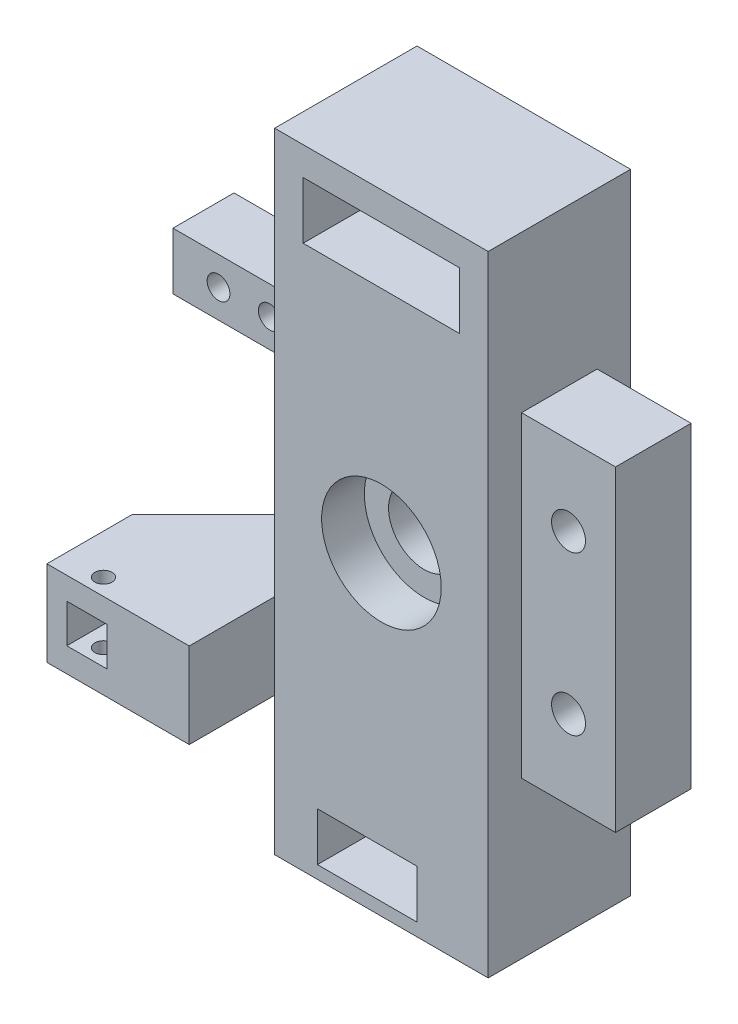
from build123d import *

# Parameters (mm, degrees)
SKETCH1_W                         = 75
SKETCH1_H                         = 50
BE_MAIN_UPRIGHT_BODY_DEPTH        = 221
SKETCH4_R                         = 12.5
CE_THROUGH_HOLE_DEPTH             = 230.667694724
SKETCH2_R                         = 21
CE_INNER_BEARING_DEPTH            = 15
SKETCH3_R                         = 23.5
CE_OUTER_BEARING_DEPTH            = 15
SKETCH7_W                         = 26.55070312
SKETCH7_H                         = 111.194580496
BE_CALIPER_MOUNT_DEPTH            = 33
SKETCH8_W                         = 21.441072272
SKETCH8_H                         = 20
BE_TEMP_SENSOR_MOUNT_DEPTH        = 50
SKETCH9_W                         = 60
SKETCH9_H                         = 30
BE_TIE_ROD_MOUNT_DEPTH            = 50
SKETCH10_R                        = 5.968024458
CE_CALIPER_HOLES_DEPTH            = 242.325913005
SKETCH12_R                        = 4
CE_TOP_CLEVIS_HOLES_DEPTH         = 243.893495178
SKETCH13_W                        = 55
SKETCH13_H                        = 20
CE_TOP_CLEVIS_SPACE_DEPTH         = 35
SKETCH14_W                        = 25
SKETCH14_H                        = 12
CE_BOTTOM_CLEVIS_SPACE_DEPTH      = 243.893495178
SKETCH15_W                        = 25
SKETCH15_H                        = 5
CE_EXPAND_BOTTOM_CLEVIS_DEPTH     = 243.893495178
CE_WIDEN_BOTTOM_CLEVIS_DEPTH      = 240.74121548
CE_WIDEN_BOTTOM_CLEVIS_DEPTH_BACK = 240.74121548
SKETCH16_W                        = 10.007554032
SKETCH16_H                        = 17
CHAMFER1_SIZE                     = 30
SKETCH18_W                        = 14.04398123
SKETCH18_H                        = 13.562779604
CUT_EXTRUDE1_DEPTH                = 20
SKETCH19_R                        = 3
CUT_EXTRUDE2_DEPTH                = 177.032667423
SKETCH20_R                        = 4
CUT_EXTRUDE3_DEPTH                = 242.780729009


with BuildPart() as part:
    # Sketch1 → BE - main upright body (new body)
    with BuildSketch(Plane(origin=(0, 0, 0), x_dir=(1, 0, 0), z_dir=(0, 1, 0))):
        Rectangle(SKETCH1_W, SKETCH1_H)
    extrude(amount=BE_MAIN_UPRIGHT_BODY_DEPTH)

    # Sketch4 → CE - Through hole (cut, through all)
    with BuildSketch(Plane.XY.offset(25)):
        with Locations((0, 110.5)):
            Circle(SKETCH4_R)
    extrude(amount=-CE_THROUGH_HOLE_DEPTH, mode=Mode.SUBTRACT)

    # Sketch2 → CE - Inner bearing (cut)
    with BuildSketch(Plane.XY.offset(25)):
        with Locations((0, 110.5)):
            Circle(SKETCH2_R)
    extrude(amount=-CE_INNER_BEARING_DEPTH, mode=Mode.SUBTRACT)

    # Sketch3 → CE - Outer bearing (cut)
    with BuildSketch(Plane(origin=(0, 0, -25), x_dir=(-1, 0, 0), z_dir=(0, 0, -1))):
        with Locations((0, 110.5)):
            Circle(SKETCH3_R)
    extrude(amount=-CE_OUTER_BEARING_DEPTH, mode=Mode.SUBTRACT)

    # Sketch7 → BE - caliper mount (add)
    with BuildSketch(Plane(origin=(37.5, 0, 0), x_dir=(0, 0, -1), z_dir=(1, 0, 0))):
        with Locations((0, 110.5)):
            Rectangle(SKETCH7_W, SKETCH7_H)
    extrude(amount=BE_CALIPER_MOUNT_DEPTH)

    # Sketch8 → BE - temp sensor mount (add)
    with BuildSketch(Plane.ZY.offset(37.5)):
        with Locations((0, 148.452249223)):
            Rectangle(SKETCH8_W, SKETCH8_H)
    extrude(amount=BE_TEMP_SENSOR_MOUNT_DEPTH)

    # Sketch9 → BE - tie rod mount (add)
    with BuildSketch(Plane.ZY.offset(37.5)):
        with Locations((25, 63.5)):
            Rectangle(SKETCH9_W, SKETCH9_H)
    extrude(amount=BE_TIE_ROD_MOUNT_DEPTH)

    # Sketch10 → CE - caliper holes (cut, through all)
    with BuildSketch(Plane.XY.offset(13.27535156)):
        with Locations((54, 138.298645124)):
            Circle(SKETCH10_R)
        with Locations((54, 82.701354876)):
            Circle(SKETCH10_R)
    extrude(amount=-CE_CALIPER_HOLES_DEPTH, mode=Mode.SUBTRACT)

    # Sketch12 → CE - top clevis holes (cut, through all)
    with BuildSketch(Plane.XY.offset(25)):
        with Locations((-12.5, 201)):
            Circle(SKETCH12_R)
        with Locations((12.5, 201)):
            Circle(SKETCH12_R)
    extrude(amount=-CE_TOP_CLEVIS_HOLES_DEPTH, mode=Mode.SUBTRACT)

    # Sketch13 → CE - top clevis space (cut)
    with BuildSketch(Plane.XY.offset(25)):
        with Locations((0, 201)):
            Rectangle(SKETCH13_W, SKETCH13_H)
    extrude(amount=-CE_TOP_CLEVIS_SPACE_DEPTH, mode=Mode.SUBTRACT)

    # Sketch14 → CE - bottom clevis space (cut, through all)
    with BuildSketch(Plane.XY.offset(25)):
        with Locations((-9.98, 10.5)):
            Rectangle(SKETCH14_W, SKETCH14_H)
    extrude(amount=-CE_BOTTOM_CLEVIS_SPACE_DEPTH, mode=Mode.SUBTRACT)

    # Sketch15 → CE - expand bottom clevis (cut, through all)
    with BuildSketch(Plane.XY.offset(25)):
        with Locations((-9.98, 19)):
            Rectangle(SKETCH15_W, SKETCH15_H)
    extrude(amount=-CE_EXPAND_BOTTOM_CLEVIS_DEPTH, mode=Mode.SUBTRACT)

    # Sketch16 → CE - widen bottom clevis (cut, two sides: drawn at the far end of the back side and taken through both)
    with BuildSketch(Plane(origin=(2.52, 4.5, 25), x_dir=(1, 0, 0), z_dir=(0, 0, 1)).offset(-CE_WIDEN_BOTTOM_CLEVIS_DEPTH_BACK)):
        with Locations((5.003777016, 8.5)):
            Rectangle(SKETCH16_W, SKETCH16_H)
    extrude(amount=CE_WIDEN_BOTTOM_CLEVIS_DEPTH + CE_WIDEN_BOTTOM_CLEVIS_DEPTH_BACK, mode=Mode.SUBTRACT)

    # Chamfer1
    chamfer1_edges = [part.edges().sort_by_distance(p)[0] for p in [
        (-87.5, 63.5, -5),
    ]]
    chamfer(chamfer1_edges, length=CHAMFER1_SIZE)

    # Sketch18 → Cut-Extrude1 (cut)
    with BuildSketch(Plane.XY.offset(55)):
        with Locations((-73.48, 63.84)):
            Rectangle(SKETCH18_W, SKETCH18_H)
    extrude(amount=-CUT_EXTRUDE1_DEPTH, mode=Mode.SUBTRACT)

    # Sketch19 → Cut-Extrude2 (cut, through all)
    with BuildSketch(Plane(origin=(0, 78.5, 0), x_dir=(1, 0, 0), z_dir=(0, 1, 0))):
        with Locations(Location((-73.48, -49.15, 0), (0, 0, 270))):
            Circle(SKETCH19_R)
    extrude(amount=-CUT_EXTRUDE2_DEPTH, mode=Mode.SUBTRACT)

    # Sketch20 → Cut-Extrude3 (cut, through all)
    with BuildSketch(Plane.XY.offset(10.720536136)):
        with Locations((-53.502606246, 148.452249223)):
            Circle(SKETCH20_R)
        with Locations((-71.497393754, 148.452249223)):
            Circle(SKETCH20_R)
    extrude(amount=-CUT_EXTRUDE3_DEPTH, mode=Mode.SUBTRACT)


solid = part.part
